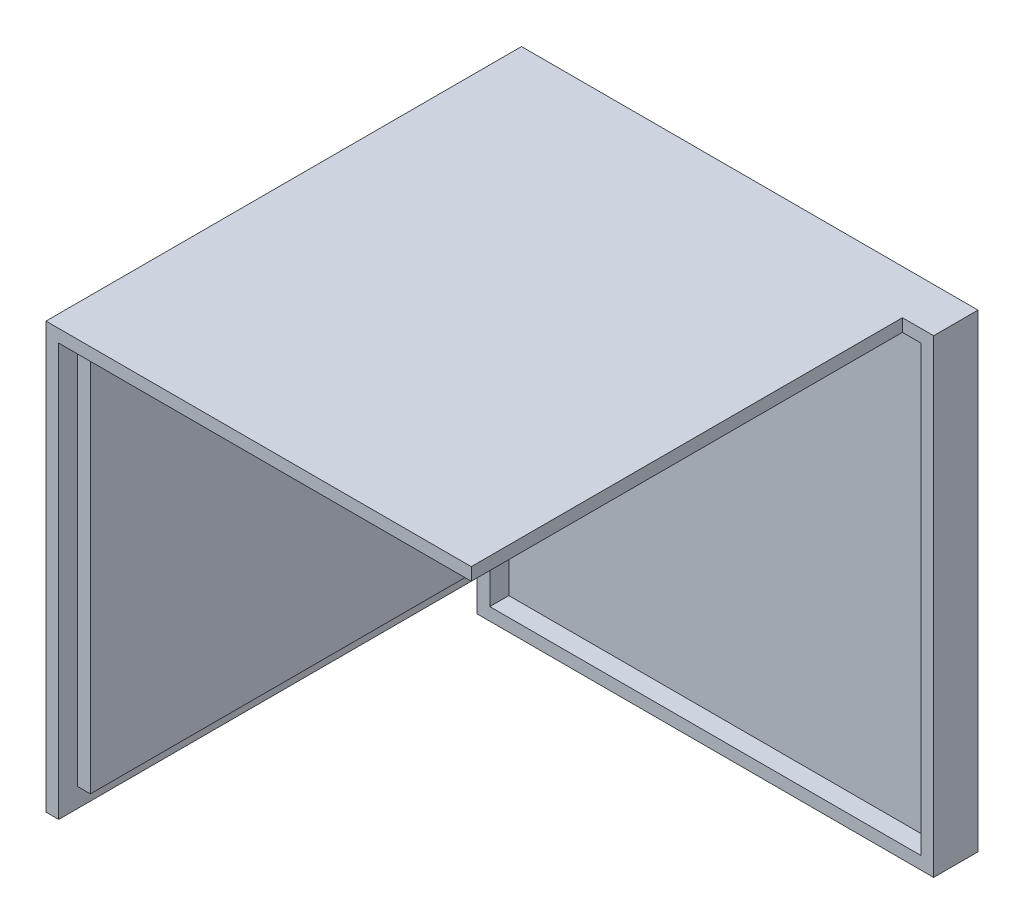
from build123d import *

# Parameters (mm, degrees)
CROQUIS1_W              = 180
CROQUIS1_H              = 185
SALIENTE_EXTRUIR1_DEPTH = 10
SALIENTE_EXTRUIR2_DEPTH = 7.5
SALIENTE_EXTRUIR3_DEPTH = 170
SALIENTE_EXTRUIR4_DEPTH = 177.5


with BuildPart() as part:
    # Croquis1 → Saliente-Extruir1 (new body)
    with BuildSketch(Plane.XY):
        with Locations((-554.698083647, 84.323121588)):
            Rectangle(CROQUIS1_W, CROQUIS1_H)
    extrude(amount=-SALIENTE_EXTRUIR1_DEPTH)

    # Croquis1<3> → Saliente-Extruir2 (add)
    with BuildSketch(Plane.XY):
        Polygon((-464.698083647, 176.823121588), (-476.998083647, 176.823121588), (-476.998083647, 171.823121588), (-469.698083647, 171.823121588), (-469.698083647, -3.176878412), (-639.698083647, -3.176878412), (-639.698083647, 9.123121588), (-644.698083647, 9.123121588), (-644.698083647, -8.176878412), (-464.698083647, -8.176878412), align=None)
    extrude(amount=SALIENTE_EXTRUIR2_DEPTH)

    # Croquis1<5> → Saliente-Extruir3 (add)
    with BuildSketch(Plane.XY):
        Polygon((-484.498083647, 166.823121588), (-484.498083647, 171.823121588), (-639.698083647, 171.823121588), (-639.698083647, 16.623121588), (-634.698083647, 16.623121588), (-634.698083647, 166.823121588), align=None)
    extrude(amount=SALIENTE_EXTRUIR3_DEPTH)

    # Croquis1<6> → Saliente-Extruir4 (add)
    with BuildSketch(Plane.XY):
        Polygon((-476.998083647, 171.823121588), (-476.998083647, 176.823121588), (-644.698083647, 176.823121588), (-644.698083647, 9.123121588), (-639.698083647, 9.123121588), (-639.698083647, 16.623121588), (-639.698083647, 171.823121588), (-484.498083647, 171.823121588), align=None)
    extrude(amount=SALIENTE_EXTRUIR4_DEPTH)


solid = part.part
